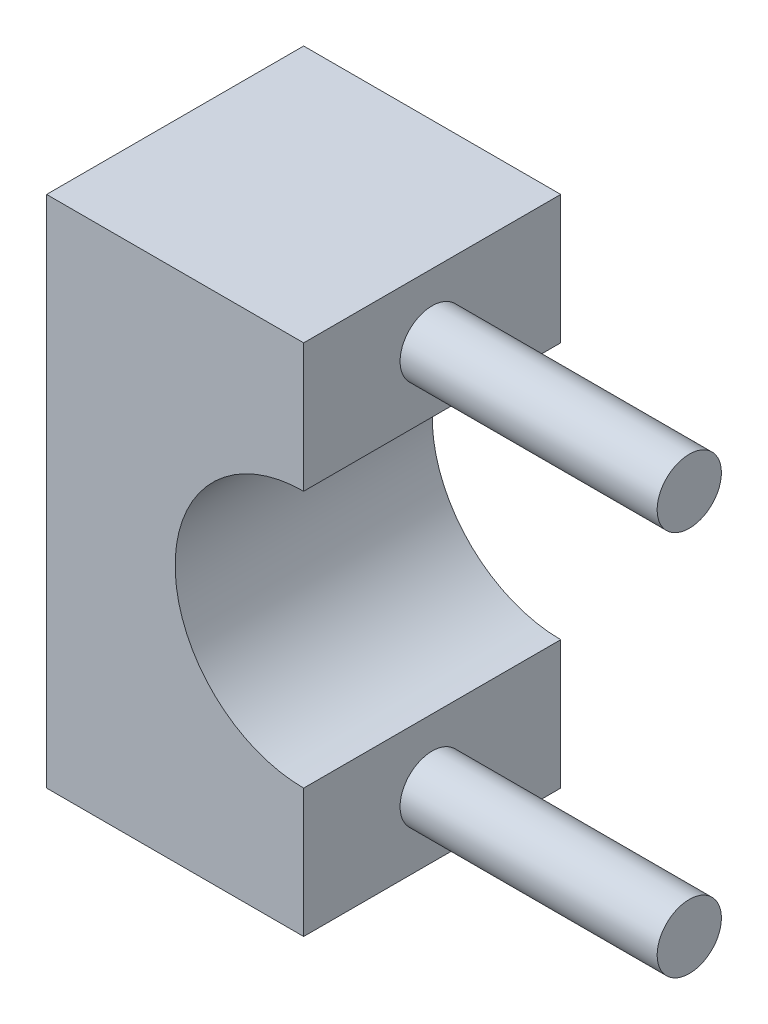
from build123d import *

# Parameters (mm, degrees)
EXTRUDE_1_DEPTH = 20
SKETCH_3_R      = 2.5
EXTRUDE_2_DEPTH = 20


with BuildPart() as part:
    # 草图1 → 凸台-拉伸1 (new body)
    with BuildSketch(Plane.XY):
        with BuildLine():
            Line((0, 20), (0, 10))
            ThreePointArc((0, 10), (-10, 0), (0, -10))
            Line((0, -10), (0, -20))
            Line((0, -20), (-20, -20))
            Line((-20, -20), (-20, 20))
            Line((-20, 20), (0, 20))
        make_face()
    extrude(amount=EXTRUDE_1_DEPTH)

    # 草图3 → 凸台-拉伸2 (add)
    with BuildSketch(Plane(origin=(0, 0, 0), x_dir=(0, 0, -1), z_dir=(1, 0, 0))):
        with Locations(Location((-10, 15, 0), (0, 0, 180))):
            Circle(SKETCH_3_R)
        with Locations(Location((-10, -15, 0), (0, 0, 180))):
            Circle(SKETCH_3_R)
    extrude(amount=EXTRUDE_2_DEPTH)


solid = part.part
